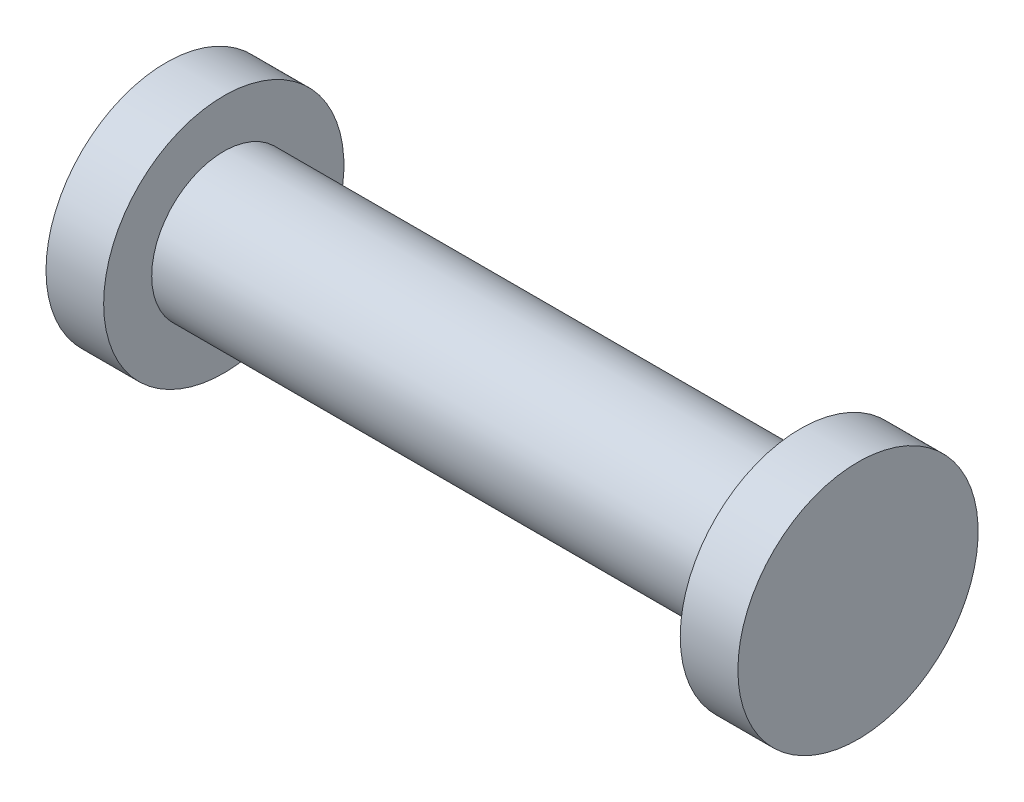
from build123d import *


with BuildPart() as part:
    # Sketch1 → Revolve2 (revolve)
    with BuildSketch(Plane(origin=(0, 0, 0), x_dir=(1, 0, 0), z_dir=(0, 1, 0)), mode=Mode.PRIVATE) as revolve2_sk:
        Polygon((36, 0), (-36, 0), (-36, 12.5), (-30, 12.5), (-30, 7.5), (30, 7.5), (30, 12.5), (36, 12.5), align=None)
    revolve(revolve2_sk.sketch.rotate(Axis((0, 0, 0), (1, 0, 0)), 180), axis=Axis((0, 0, 0), (1, 0, 0)))


solid = part.part
